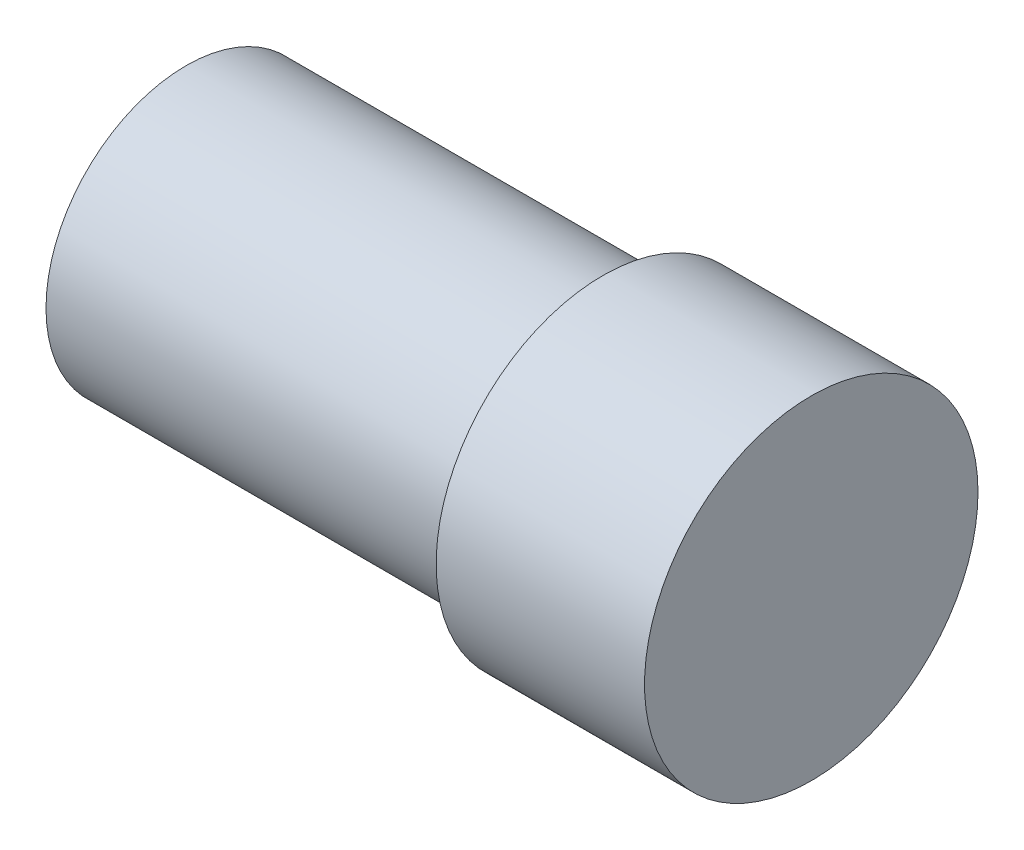
from build123d import *

# Parameters (mm, degrees)
SKETCH1_R                       = 5.08
BOSS_EXTRUDE1_DEPTH             = 6.35
SKETCH2_R                       = 4.2672
BOSS_EXTRUDE2_DEPTH             = 12.7
F_21_0_159_DIAMETER_HOLE1_D     = 3.999999874
F_21_0_159_DIAMETER_HOLE1_DEPTH = 12.7


with BuildPart() as part:
    # Sketch1 → Boss-Extrude1 (new body)
    with BuildSketch(Plane(origin=(0, 0, 0), x_dir=(0, 0, -1), z_dir=(1, 0, 0))):
        Circle(SKETCH1_R)
    extrude(amount=BOSS_EXTRUDE1_DEPTH)

    # Sketch2 → Boss-Extrude2 (add)
    with BuildSketch(Plane.ZY):
        with Locations(Location((0, 0, 0), (0, 0, 180))):
            Circle(SKETCH2_R)
    extrude(amount=BOSS_EXTRUDE2_DEPTH)

    # #21 (0.159) Diameter Hole1
    with Locations(Plane.ZY.offset(12.7)):
        with Locations((0, 0)):
            Hole(F_21_0_159_DIAMETER_HOLE1_D / 2, depth=F_21_0_159_DIAMETER_HOLE1_DEPTH)


solid = part.part
